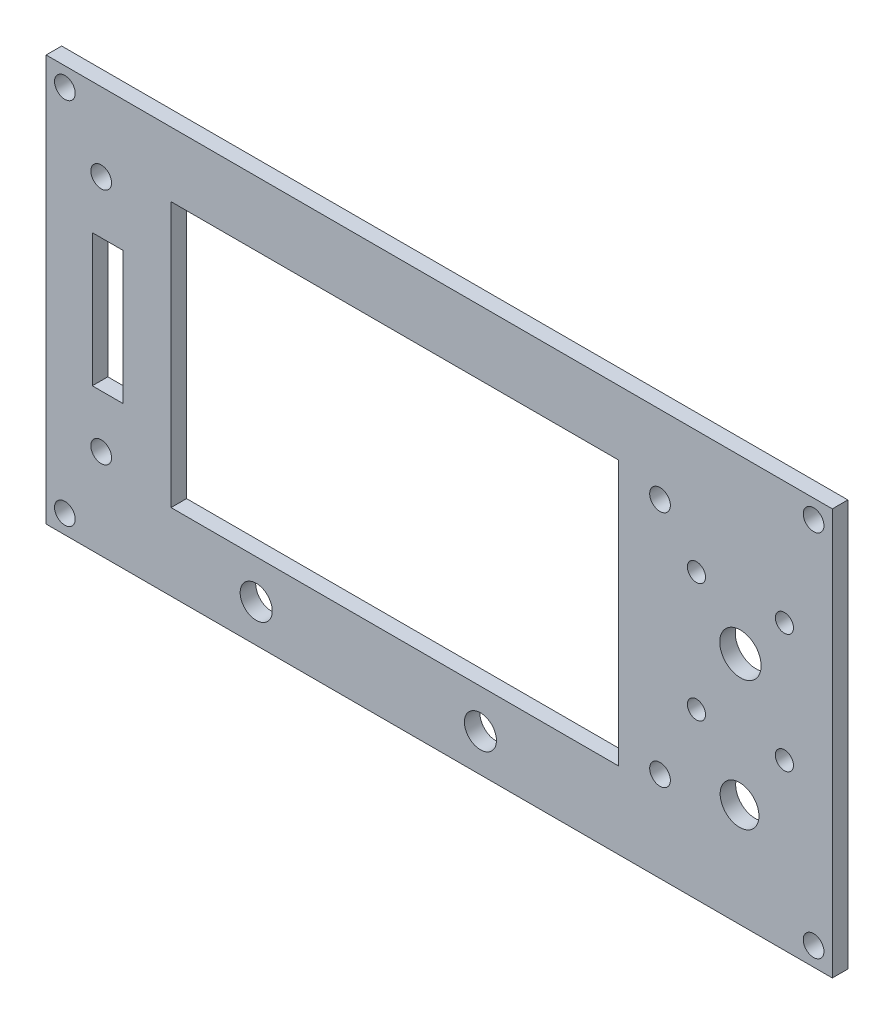
from build123d import *

# Parameters (mm, degrees)
ESQUISSE1_W        = 151.93976922
ESQUISSE1_H        = 78.51687395
ESQUISSE1_R        = 2
ESQUISSE1_R_2      = 4
ESQUISSE1_R_3      = 1.75
ESQUISSE1_R_4      = 3.75
ESQUISSE1_R_5      = 3.1
ESQUISSE1_W_2      = 86.5
ESQUISSE1_H_2      = 51.2
ESQUISSE1_W_3      = 5.937566171
ESQUISSE1_H_3      = 25.632907614
BOSS_EXTRU_1_DEPTH = 3


with BuildPart() as part:
    # Esquisse1 → Boss.-Extru.1 (new body)
    with BuildSketch(Plane.XY.offset(-2.2)):
        with Locations((-43.862390942, 0.647054174)):
            Rectangle(ESQUISSE1_W, ESQUISSE1_H)
        with Locations((-109.194417438, 24.821428571)):
            Circle(ESQUISSE1_R, mode=Mode.SUBTRACT)
        with Locations((-109.194417438, -21.178571429)):
            Circle(ESQUISSE1_R, mode=Mode.SUBTRACT)
        with Locations((-1.194417438, -21.178571429)):
            Circle(ESQUISSE1_R, mode=Mode.SUBTRACT)
        with Locations((-1.194417438, 24.821428571)):
            Circle(ESQUISSE1_R, mode=Mode.SUBTRACT)
        with Locations((-116.210955208, 36.284170806)):
            Circle(ESQUISSE1_R, mode=Mode.SUBTRACT)
        with Locations((-116.210955208, -34.990062458)):
            Circle(ESQUISSE1_R, mode=Mode.SUBTRACT)
        with Locations((28.486173324, 36.284170806)):
            Circle(ESQUISSE1_R, mode=Mode.SUBTRACT)
        with Locations((28.486173324, -34.990062458)):
            Circle(ESQUISSE1_R, mode=Mode.SUBTRACT)
        with Locations((14.345224597, 6.749852674)):
            Circle(ESQUISSE1_R_2, mode=Mode.SUBTRACT)
        with Locations((5.845224597, 16.204342535)):
            Circle(ESQUISSE1_R_3, mode=Mode.SUBTRACT)
        with Locations((22.845224597, 16.204342535)):
            Circle(ESQUISSE1_R_3, mode=Mode.SUBTRACT)
        with Locations((22.845224597, -6.795657465)):
            Circle(ESQUISSE1_R_3, mode=Mode.SUBTRACT)
        with Locations((5.845224597, -6.795657465)):
            Circle(ESQUISSE1_R_3, mode=Mode.SUBTRACT)
        with Locations((14.176552179, -18.611382801)):
            Circle(ESQUISSE1_R_4, mode=Mode.SUBTRACT)
        with Locations((-79.237508709, -31.316718293)):
            Circle(ESQUISSE1_R_5, mode=Mode.SUBTRACT)
        with Locations((-35.905557573, -31.316718293)):
            Circle(ESQUISSE1_R_5, mode=Mode.SUBTRACT)
        with Locations((-52.444417438, 1.821428571)):
            Rectangle(ESQUISSE1_W_2, ESQUISSE1_H_2, mode=Mode.SUBTRACT)
        with Locations((-107.94493025, 1.811094224)):
            Rectangle(ESQUISSE1_W_3, ESQUISSE1_H_3, mode=Mode.SUBTRACT)
    extrude(amount=BOSS_EXTRU_1_DEPTH)


solid = part.part
